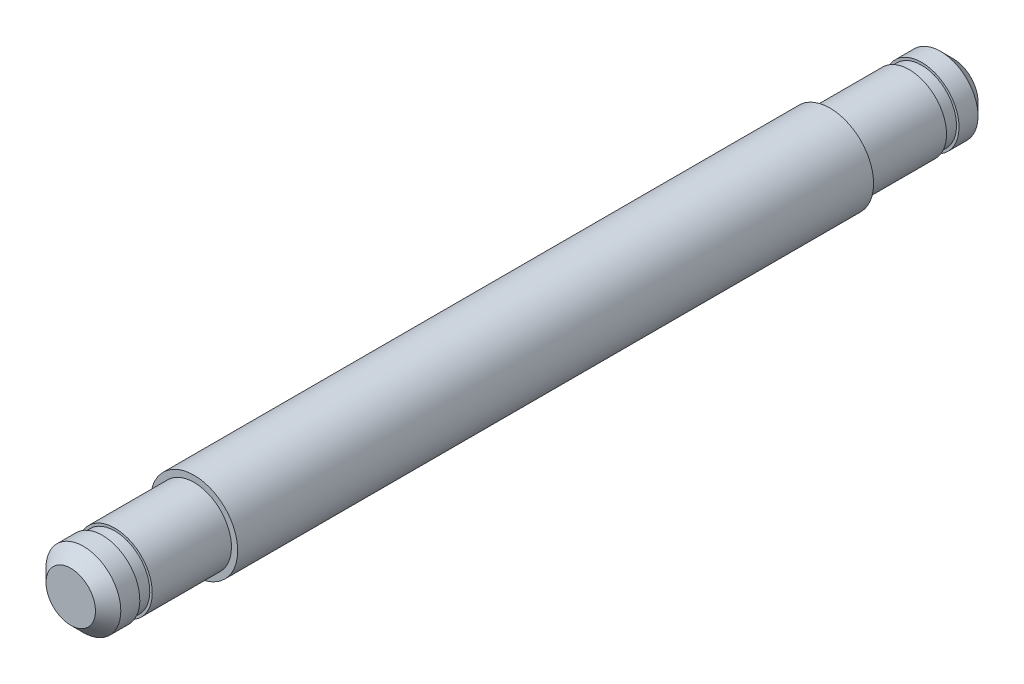
from build123d import *

# Parameters (mm, degrees)
CHAMFER1_SIZE = 0.508


with BuildPart() as part:
    # Sketch1 → Revolve2 (revolve)
    with BuildSketch(Plane(origin=(0, 0, 0), x_dir=(0, 0, -1), z_dir=(1, 0, 0))):
        Polygon((-17.6958, 0), (-17.6958, 1.5), (-16.4258, 1.5), (-16.4258, 1.4), (-15.9258, 1.4), (-15.9258, 1.5), (-12.7508, 1.5), (-12.7508, 1.75), (0, 1.75), (0, 0), align=None)
    revolve2 = revolve(axis=Axis((0, 0, 0.682962963), (0, 0, 1)))

    # Mirror1: Revolve2 across plane
    add(revolve2.mirror(Plane.XY))

    # Chamfer1
    chamfer1_edges = [part.edges().sort_by_distance(p)[0] for p in [
        (0, -1.5, -17.6958),
        (0, -1.5, 17.6958),
    ]]
    chamfer(chamfer1_edges, length=CHAMFER1_SIZE)


solid = part.part
